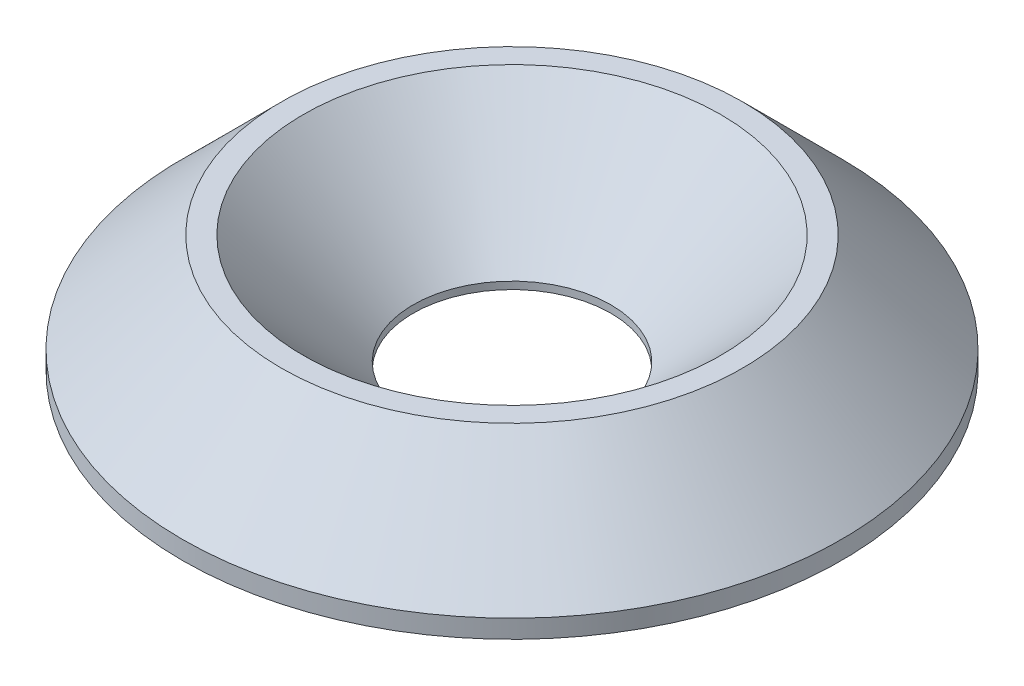
from build123d import *


with BuildPart() as part:
    # Esquisse1 → Révolution1 (revolve)
    with BuildSketch(Plane.XY, mode=Mode.PRIVATE) as r_volution1_sk:
        Polygon((1.35, 0), (4.5, 0), (4.5, 0.25), (3.15, 1.6), (2.85, 1.6), (1.35, 0.1), align=None)
    revolve(r_volution1_sk.sketch.rotate(Axis((0, 0, 0), (0, 1, 0)), 90), axis=Axis((0, 0, 0), (0, 1, 0)))


solid = part.part
